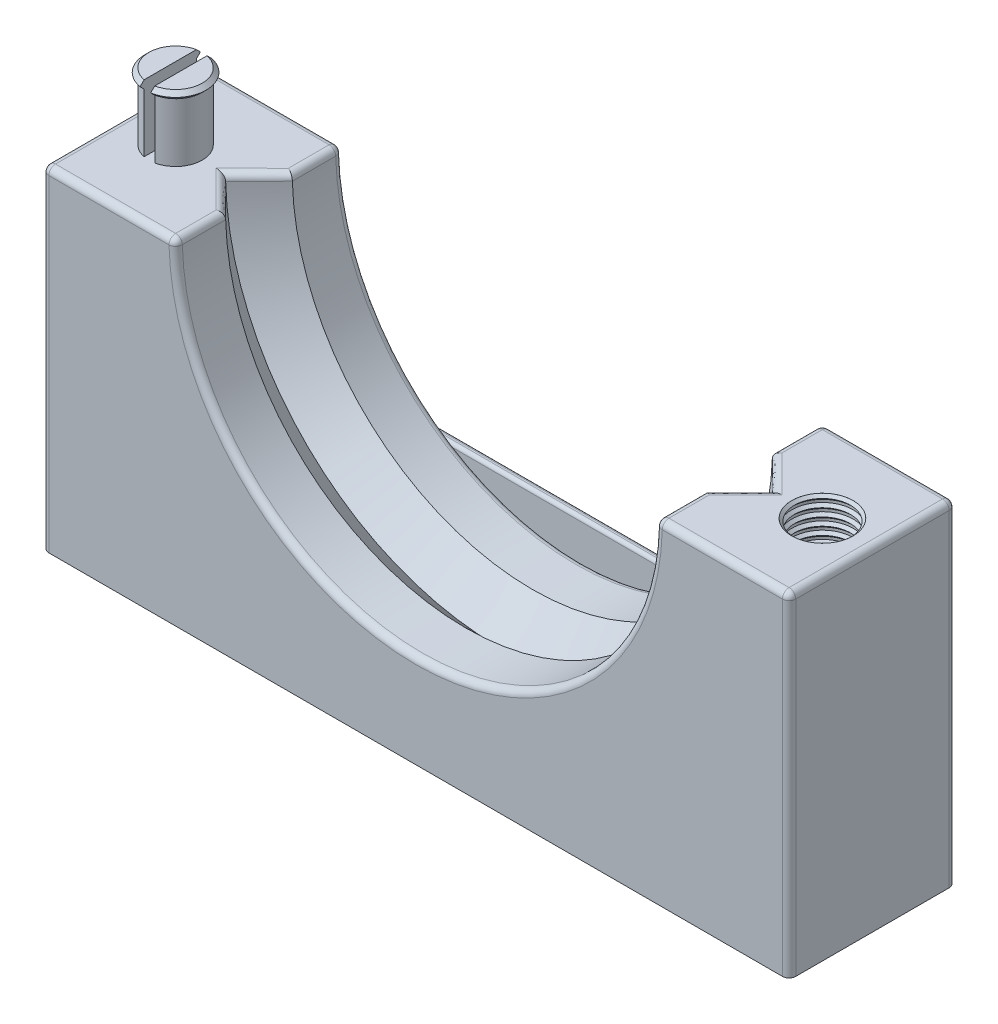
from build123d import *

# Parameters (mm, degrees)
BOSS_EXTRUDE1_DEPTH = 15.875
SKETCH6_R           = 2.921
CUT_EXTRUDE2_DEPTH  = 9.525
CUT_EXTRUDE3_REACH  = 56.481
SKETCH16_W          = 1.016
SKETCH16_H          = 11.1836739
SKETCH17_W          = 38.1
SKETCH17_H          = 9.4488
BOSS_EXTRUDE2_DEPTH = 1.5875
SKETCH18_W          = 38.1
SKETCH18_H          = 7.62
BOSS_EXTRUDE3_DEPTH = 0.8
FILLET1_R           = 0.635
FILLET2_R           = 0.3175


with BuildPart() as part:
    # Sketch1 → Boss-Extrude1 (new body)
    with BuildSketch(Plane.XY):
        with BuildLine():
            Line((-35.56, 0), (35.56, 0))
            Line((35.56, 0), (35.56, 31.75))
            Line((35.56, 31.75), (22.86, 31.75))
            ThreePointArc((22.86, 31.75), (0, 8.89), (-22.86, 31.75))
            Line((-22.86, 31.75), (-35.56, 31.75))
            Line((-35.56, 31.75), (-35.56, 0))
        make_face()
    extrude(amount=BOSS_EXTRUDE1_DEPTH)

    # Sketch2 → Cut-Revolve1 (revolve, cut)
    with BuildSketch(Plane(origin=(0, 31.75, 0), x_dir=(1, 0, 0), z_dir=(0, 1, 0))):
        Polygon((22.86, -11.1125), (26.035, -7.9375), (22.86, -4.7625), align=None)
    revolve(axis=Axis((0, 31.75, 0), (0, 0, 1)), mode=Mode.SUBTRACT)

    # Sketch6 → Cut-Extrude2 (cut)
    with BuildSketch(Plane(origin=(0, 31.75, 0), x_dir=(1, 0, 0), z_dir=(0, 1, 0))):
        with Locations(Location((30.7975, -7.9375, 0), (0, 0, 180))):
            Circle(SKETCH6_R)
    extrude(amount=-CUT_EXTRUDE2_DEPTH, mode=Mode.SUBTRACT)

    # Sketch15 → Revolve2 (revolve)
    with BuildSketch(Plane.XY.offset(7.9375), mode=Mode.PRIVATE) as revolve2_sk:
        Polygon((-33.3375, 31.75), (-33.3375, 37.338), (-33.7185, 37.719), (-33.3375, 38.1), (-30.7975, 38.1), (-30.7975, 31.75), align=None)
    revolve(revolve2_sk.sketch.rotate(Axis((-30.7975, 38.1, 7.9375), (0, -1, 0)), 270), axis=Axis((-30.7975, 38.1, 7.9375), (0, -1, 0)))

    # Cut-Extrude3: up to this face of the body (flat: up to its plane)
    cut_extrude3_end = Plane(part.part.faces().sort_by_distance((-29.21, 31.75, 0.203299195))[0])
    # Sketch16 → Cut-Extrude3 (cut, up to the picked face)
    with BuildSketch(Plane(origin=(0, 38.1, 0), x_dir=(1, 0, 0), z_dir=(0, 1, 0)), mode=Mode.PRIVATE) as cut_extrude3_sk1:
        with Locations((-30.7975, -7.9375)):
            Rectangle(SKETCH16_W, SKETCH16_H)
    cut_extrude3_tool1 = split(extrude(cut_extrude3_sk1.sketch, amount=-CUT_EXTRUDE3_REACH, mode=Mode.PRIVATE), bisect_by=cut_extrude3_end, keep=Keep.BOTH, mode=Mode.PRIVATE)
    add(cut_extrude3_tool1.solids().sort_by(Axis((-30.7975, 38.1, 7.9375), (0, -1, 0)))[0], mode=Mode.SUBTRACT)

    # Sketch17 → Boss-Extrude2 (add)
    with BuildSketch(Plane(origin=(0, 0, 0), x_dir=(1, 0, 0), z_dir=(0, 1, 0))):
        Rectangle(SKETCH17_W, SKETCH17_H)
    extrude(amount=BOSS_EXTRUDE2_DEPTH)

    # Sketch18 → Boss-Extrude3 (add)
    with BuildSketch(Plane(origin=(0, 0, -4.7244), x_dir=(-1, 0, 0), z_dir=(0, 0, -1))):
        with Locations((0, 3.81)):
            Rectangle(SKETCH18_W, SKETCH18_H)
    extrude(amount=BOSS_EXTRUDE3_DEPTH)

    # Fillet1
    fillet1_edges = [part.edges().sort_by_distance(p)[0] for p in [
        (35.56, 15.875, 15.875),
        (-35.56, 31.75, 7.9375),
        (-22.86, 31.75, 13.49375),
        (22.86, 31.75, 13.49375),
        (35.56, 31.75, 7.9375),
        (29.21, 31.75, 15.875),
        (0, 8.89, 15.875),
        (-29.21, 31.75, 15.875),
        (-22.86, 31.75, 2.38125),
        (-24.4475, 31.75, 6.35),
        (-24.4475, 31.75, 9.525),
        (22.86, 31.75, 2.38125),
        (24.4475, 31.75, 9.525),
        (24.4475, 31.75, 6.35),
        (-35.56, 15.875, 15.875),
        (-29.21, 31.75, 0),
        (0, 8.89, 0),
        (29.21, 31.75, 0),
        (35.56, 15.875, 0),
        (-35.56, 15.875, 0),
    ]]
    fillet(fillet1_edges, radius=FILLET1_R)

    # Fillet2
    fillet2_edges = [part.edges().sort_by_distance(p)[0] for p in [
        (19.05, 0.79375, 0),
        (0, 1.5875, 0),
        (-19.05, 0.79375, 0),
        (-19.05, 1.5875, -2.3622),
        (19.05, 1.5875, -2.3622),
        (19.05, 4.60375, -4.7244),
        (0, 7.62, -4.7244),
        (-19.05, 4.60375, -4.7244),
        (0, 7.62, -5.5244),
        (19.05, 3.81, -5.5244),
        (-19.05, 3.81, -5.5244),
    ]]
    fillet(fillet2_edges, radius=FILLET2_R)


with BuildPart() as body_2:
    # Sketch12 → Revolve1 (revolve)
    with BuildSketch(Plane.XY.offset(7.9375), mode=Mode.PRIVATE) as revolve1_sk:
        Polygon((27.8765, 30.48), (28.1305, 30.734), (27.8765, 30.988), align=None)
        Polygon((27.8765, 31.242), (28.1305, 31.496), (27.8765, 31.75), align=None)
        Polygon((27.8765, 29.718), (28.1305, 29.972), (27.8765, 30.226), align=None)
        Polygon((27.8765, 28.956), (28.1305, 29.21), (27.8765, 29.464), align=None)
        Polygon((27.8765, 28.194), (28.1305, 28.448), (27.8765, 28.702), align=None)
        Polygon((27.8765, 27.432), (28.1305, 27.686), (27.8765, 27.94), align=None)
        Polygon((27.8765, 26.67), (28.1305, 26.924), (27.8765, 27.178), align=None)
        Polygon((27.8765, 25.908), (28.1305, 26.162), (27.8765, 26.416), align=None)
        Polygon((27.8765, 25.146), (28.1305, 25.4), (27.8765, 25.654), align=None)
        Polygon((27.8765, 24.384), (28.1305, 24.638), (27.8765, 24.892), align=None)
        Polygon((27.8765, 23.622), (28.1305, 23.876), (27.8765, 24.13), align=None)
        Polygon((27.8765, 22.86), (28.1305, 23.114), (27.8765, 23.368), align=None)
        Polygon((27.8765, 22.098), (28.1305, 22.352), (27.8765, 22.606), align=None)
        Polygon((27.8765, 21.336), (28.1305, 21.59), (27.8765, 21.844), align=None)
        Polygon((27.8765, 20.574), (28.1305, 20.828), (27.8765, 21.082), align=None)
        Polygon((27.8765, 19.812), (28.1305, 20.066), (27.8765, 20.32), align=None)
        Polygon((27.8765, 19.05), (28.1305, 19.304), (27.8765, 19.558), align=None)
        Polygon((27.8765, 18.288), (28.1305, 18.542), (27.8765, 18.796), align=None)
        Polygon((27.8765, 17.526), (28.1305, 17.78), (27.8765, 18.034), align=None)
        Polygon((27.8765, 16.764), (28.1305, 17.018), (27.8765, 17.272), align=None)
    revolve(revolve1_sk.sketch.rotate(Axis((30.7975, 31.75, 7.9375), (0, -1, 0)), 270), axis=Axis((30.7975, 31.75, 7.9375), (0, -1, 0)))


solid = Compound([part.part, body_2.part])
